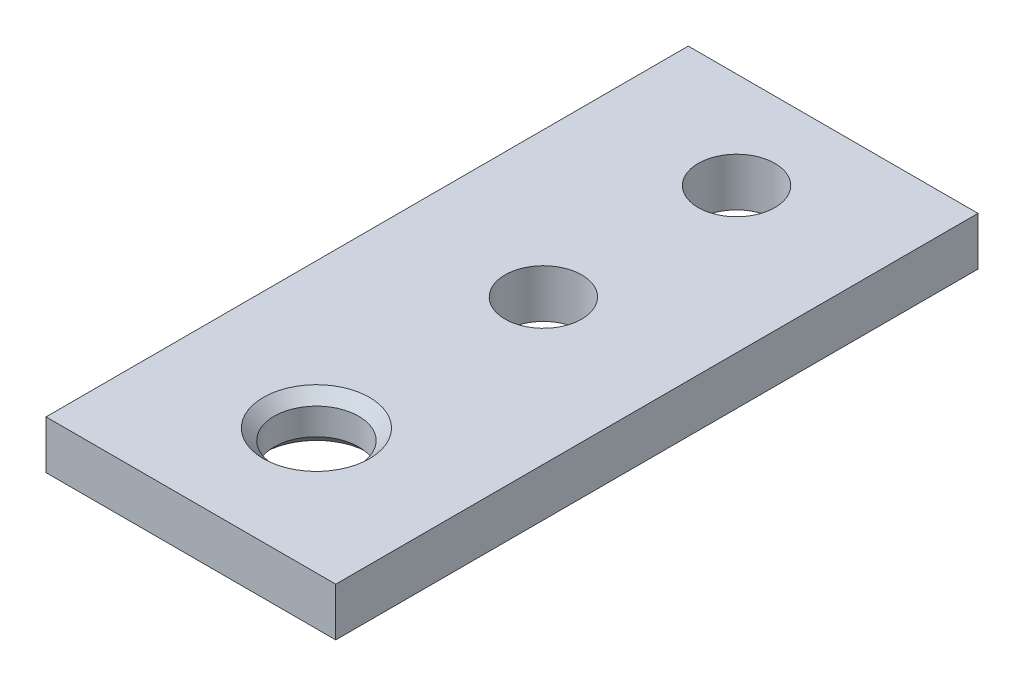
from build123d import *

# Parameters (mm, degrees)
SKETCH1_W                   = 38.1
SKETCH1_H                   = 6.35
EXTRUDE1_DEPTH              = 84.455
F_3_8_CLEARANCE_HOLE1_D     = 10.0838
F_3_8_CLEARANCE_HOLE1_DEPTH = 16.002
F_3_8_CLEARANCE_HOLE1_TIP   = 3.029479155


with BuildPart() as part:
    # Sketch1 → Extrude1 (new body)
    with BuildSketch(Plane.XY):
        Rectangle(SKETCH1_W, SKETCH1_H)
    extrude(amount=EXTRUDE1_DEPTH)

    # 3/8 Clearance Hole1
    with Locations(Plane(origin=(0, 3.175, 12.7), x_dir=(0, 0, 1), z_dir=(0, 1, 0))):
        with Locations((0, 0), (25.4, 0)):
            Hole(F_3_8_CLEARANCE_HOLE1_D / 2, depth=F_3_8_CLEARANCE_HOLE1_DEPTH)
            with Locations((0, 0, -(F_3_8_CLEARANCE_HOLE1_DEPTH + F_3_8_CLEARANCE_HOLE1_TIP / 2))):  # 118° drill point
                Cone(0, F_3_8_CLEARANCE_HOLE1_D / 2, F_3_8_CLEARANCE_HOLE1_TIP, mode=Mode.SUBTRACT)

    # Sketch4 → 7/16 (0.4375) Diameter Hole2 (revolve, cut)
    with BuildSketch(Plane(origin=(0, 3.175, 67.945), x_dir=(0, 0, 1), z_dir=(1, 0, 0))):
        Polygon((0, 0), (0, 6.35), (6.985, 6.35), (5.55625, 4.92125), (5.55625, 1.42875), (6.985, 0), align=None)
    revolve(axis=Axis((0, 9.525, 67.945), (0, -1, 0)), mode=Mode.SUBTRACT)


solid = part.part
